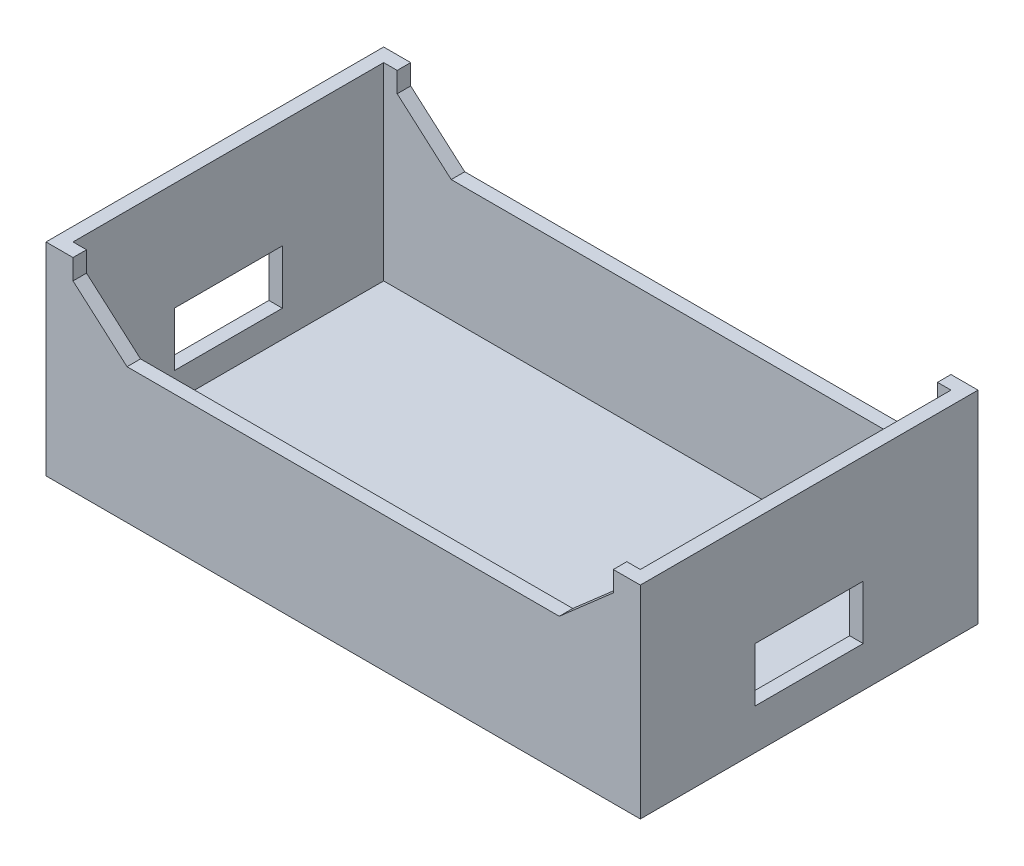
from build123d import *

# Parameters (mm, degrees)
CROQUIS1_W              = 44
CROQUIS1_H              = 25
SALIENTE_EXTRUIR2_DEPTH = 10
CROQUIS2_W              = 42
CROQUIS2_H              = 23
CORTAR_EXTRUIR1_DEPTH   = 9
SALIENTE_EXTRUIR3_DEPTH = 25
CROQUIS4_W              = 42
CROQUIS4_H              = 23
CORTAR_EXTRUIR2_DEPTH   = 28
CROQUIS5_W              = 1
CROQUIS5_H              = 23
CORTAR_EXTRUIR10_DEPTH  = 5
CROQUIS6_W              = 29.89343235
CROQUIS6_H              = 11.447342814
CORTAR_EXTRUIR11_DEPTH  = 1
CROQUIS7_W              = 31.003837105
CROQUIS7_H              = 9.868746677
CORTAR_EXTRUIR12_DEPTH  = 1
CROQUIS8_W              = 1
CROQUIS8_H              = 23
SALIENTE_EXTRUIR4_DEPTH = 5
CROQUIS9_W              = 8
CROQUIS9_H              = 4
CORTAR_EXTRUIR17_DEPTH  = 87


with BuildPart() as part:
    # Croquis1 → Saliente-Extruir2 (new body)
    with BuildSketch(Plane(origin=(0, 0, 0), x_dir=(1, 0, 0), z_dir=(0, 1, 0))):
        Rectangle(CROQUIS1_W, CROQUIS1_H)
    extrude(amount=SALIENTE_EXTRUIR2_DEPTH)

    # Croquis2 → Cortar-Extruir1 (cut)
    with BuildSketch(Plane(origin=(0, 10, 0), x_dir=(1, 0, 0), z_dir=(0, 1, 0))):
        Rectangle(CROQUIS2_W, CROQUIS2_H)
    extrude(amount=-CORTAR_EXTRUIR1_DEPTH, mode=Mode.SUBTRACT)

    # Croquis3 → Saliente-Extruir3 (add)
    with BuildSketch(Plane.XY.offset(12.5)):
        Polygon((-22, 8), (-22, 10), (-16, 10), (-20, 13.5), (-20, 15), (-23, 15), (-23, 8), align=None)
        Polygon((20, 13.5), (16, 10), (22, 10), (22, 8), (23, 8), (23, 15), (20, 15), align=None)
    extrude(amount=-SALIENTE_EXTRUIR3_DEPTH)

    # Croquis4 → Cortar-Extruir2 (cut)
    with BuildSketch(Plane(origin=(0, 1, 0), x_dir=(1, 0, 0), z_dir=(0, 1, 0))):
        Rectangle(CROQUIS4_W, CROQUIS4_H)
    extrude(amount=CORTAR_EXTRUIR2_DEPTH, mode=Mode.SUBTRACT)

    # Croquis5 → Cortar-Extruir10 (cut)
    with BuildSketch(Plane(origin=(0, 15, 0), x_dir=(1, 0, 0), z_dir=(0, 1, 0))):
        with Locations((-21.5, 0)):
            Rectangle(CROQUIS5_W, CROQUIS5_H)
        with Locations((21.5, 0)):
            Rectangle(CROQUIS5_W, CROQUIS5_H)
    extrude(amount=-CORTAR_EXTRUIR10_DEPTH, mode=Mode.SUBTRACT)

    # Croquis6 → Cortar-Extruir11 (cut)
    with BuildSketch(Plane(origin=(23, 0, 0), x_dir=(0, 0, -1), z_dir=(1, 0, 0))):
        with Locations((-0.524699003, 11.114026003)):
            Rectangle(CROQUIS6_W, CROQUIS6_H)
    extrude(amount=-CORTAR_EXTRUIR11_DEPTH, mode=Mode.SUBTRACT)

    # Croquis7 → Cortar-Extruir12 (cut)
    with BuildSketch(Plane.ZY.offset(23)):
        with Locations((-0.729719636, 12.255463236)):
            Rectangle(CROQUIS7_W, CROQUIS7_H)
    extrude(amount=-CORTAR_EXTRUIR12_DEPTH, mode=Mode.SUBTRACT)

    # Croquis8 → Saliente-Extruir4 (add)
    with BuildSketch(Plane(origin=(0, 10, 0), x_dir=(1, 0, 0), z_dir=(0, 1, 0))):
        with Locations((-21.5, 0)):
            Rectangle(CROQUIS8_W, CROQUIS8_H)
        with Locations((21.5, 0)):
            Rectangle(CROQUIS8_W, CROQUIS8_H)
    extrude(amount=SALIENTE_EXTRUIR4_DEPTH)

    # Croquis9 → Cortar-Extruir17 (cut)
    with BuildSketch(Plane.ZY.offset(22)):
        with Locations((0, 5)):
            Rectangle(CROQUIS9_W, CROQUIS9_H)
    extrude(amount=-CORTAR_EXTRUIR17_DEPTH, mode=Mode.SUBTRACT)


solid = part.part
